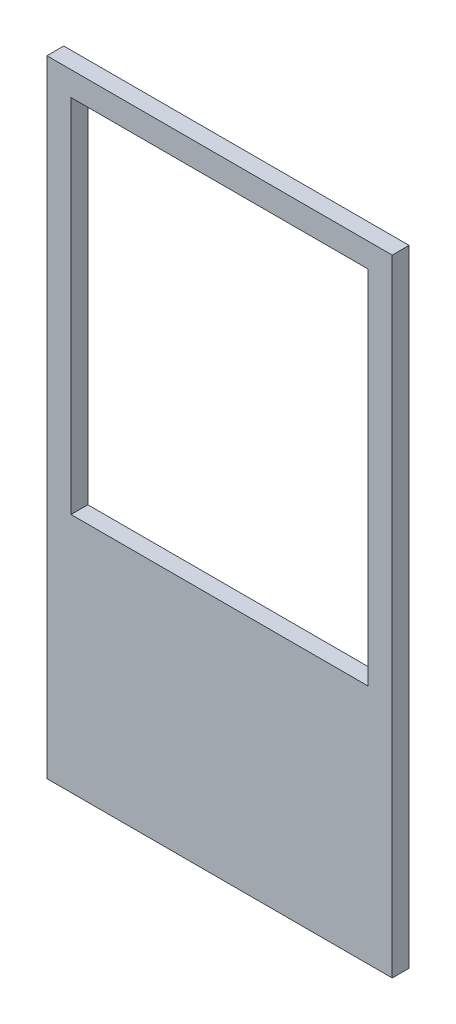
from build123d import *

# Parameters (mm, degrees)
SKETCH2_W           = 1434.02
SKETCH2_H           = 2600
SKETCH2_W_2         = 1234.02
SKETCH2_H_2         = 1499.72
BOSS_EXTRUDE1_DEPTH = 70


with BuildPart() as part:
    # Sketch2 → Boss-Extrude1 (new body)
    with BuildSketch(Plane.XY):
        Rectangle(SKETCH2_W, SKETCH2_H)
        with Locations((0, 449.86)):
            Rectangle(SKETCH2_W_2, SKETCH2_H_2, mode=Mode.SUBTRACT)
    extrude(amount=BOSS_EXTRUDE1_DEPTH)


solid = part.part
